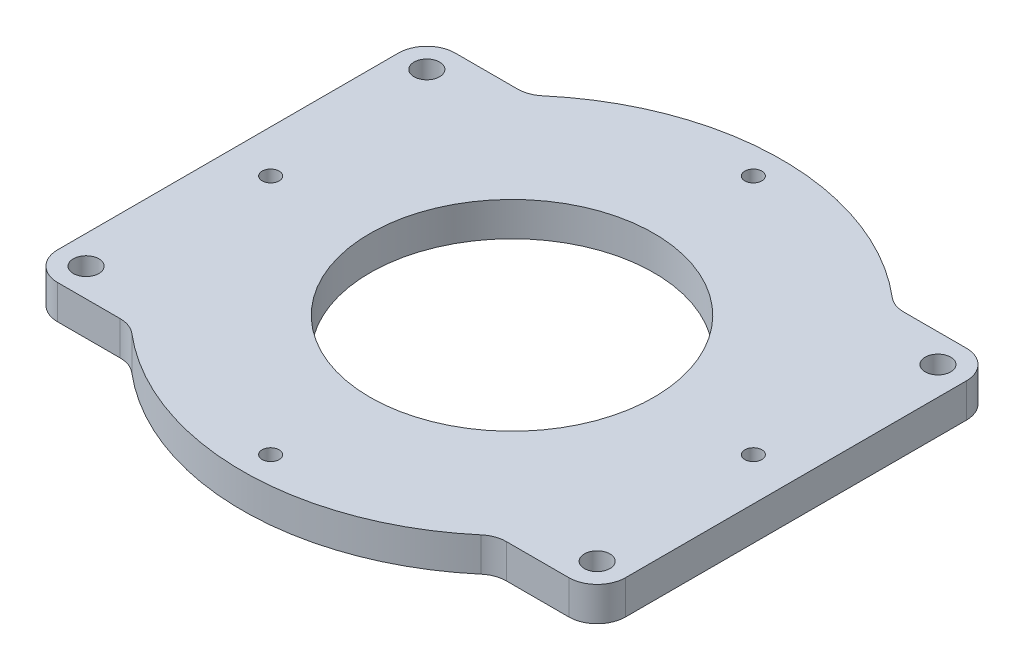
from build123d import *

# Parameters (mm, degrees)
SKETCH1_R           = 2.25
SKETCH1_R_2         = 25
SKETCH1_R_3         = 1.5
BOSS_EXTRUDE1_DEPTH = 6


with BuildPart() as part:
    # Sketch1 → Boss-Extrude1 (new body)
    with BuildSketch(Plane(origin=(0, 0, 0), x_dir=(1, 0, 0), z_dir=(0, 1, 0))):
        with BuildLine():
            Line((50, -30), (50, 30))
            ThreePointArc((50, 30), (48.535533906, 33.535533906), (45, 35))
            Line((45, 35), (34.003676272, 35))
            ThreePointArc((34.003676272, 35), (32.278512373, 35.307046823), (30.765230913, 36.19047619))
            ThreePointArc((30.765230913, 36.19047619), (0, 47.5), (-30.765230913, 36.19047619))
            ThreePointArc((-30.765230913, 36.19047619), (-32.278512373, 35.307046823), (-34.003676272, 35))
            Line((-34.003676272, 35), (-45, 35))
            ThreePointArc((-45, 35), (-48.535533906, 33.535533906), (-50, 30))
            Line((-50, 30), (-50, -30))
            ThreePointArc((-50, -30), (-48.535533906, -33.535533906), (-45, -35))
            Line((-45, -35), (-34.003676272, -35))
            ThreePointArc((-34.003676272, -35), (-32.278512373, -35.307046823), (-30.765230913, -36.19047619))
            ThreePointArc((-30.765230913, -36.19047619), (0, -47.5), (30.765230913, -36.19047619))
            ThreePointArc((30.765230913, -36.19047619), (32.278512373, -35.307046823), (34.003676272, -35))
            Line((34.003676272, -35), (45, -35))
            ThreePointArc((45, -35), (48.535533906, -33.535533906), (50, -30))
        make_face()
        with Locations(Location((-45, 30, 0), (0, 0, 270))):
            Circle(SKETCH1_R, mode=Mode.SUBTRACT)
        with Locations(Location((-45, -30, 0), (0, 0, 270))):
            Circle(SKETCH1_R, mode=Mode.SUBTRACT)
        with Locations(Location((45, -30, 0), (0, 0, 270))):
            Circle(SKETCH1_R, mode=Mode.SUBTRACT)
        with Locations(Location((45, 30, 0), (0, 0, 270))):
            Circle(SKETCH1_R, mode=Mode.SUBTRACT)
        with Locations(Location((0, 0, 0), (0, 0, 270))):
            Circle(SKETCH1_R_2, mode=Mode.SUBTRACT)
        with Locations(Location((0, 42.5, 0), (0, 0, 270))):
            Circle(SKETCH1_R_3, mode=Mode.SUBTRACT)
        with Locations(Location((42.5, 0, 0), (0, 0, 270))):
            Circle(SKETCH1_R_3, mode=Mode.SUBTRACT)
        with Locations(Location((0, -42.5, 0), (0, 0, 90))):
            Circle(SKETCH1_R_3, mode=Mode.SUBTRACT)
        with Locations(Location((-42.5, 0, 0), (0, 0, 90))):
            Circle(SKETCH1_R_3, mode=Mode.SUBTRACT)
    extrude(amount=BOSS_EXTRUDE1_DEPTH)


solid = part.part
